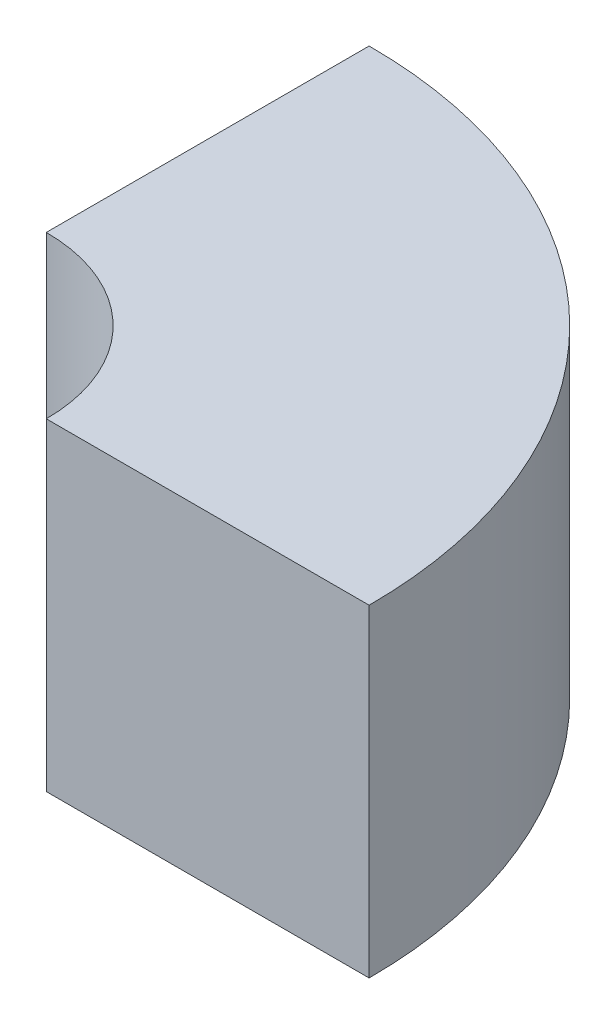
from build123d import *

# Parameters (mm, degrees)
SKETCH_1_W      = 10
SKETCH_1_H      = 10
REVOLVE_1_ANGLE = 90


with BuildPart() as part:
    # 草图1 → 旋转1 (revolve)
    with BuildSketch(Plane.XY):
        with Locations((10, 5)):
            Rectangle(SKETCH_1_W, SKETCH_1_H)
    revolve(axis=Axis((0, 0, 0), (0, 1, 0)), revolution_arc=REVOLVE_1_ANGLE)


solid = part.part
